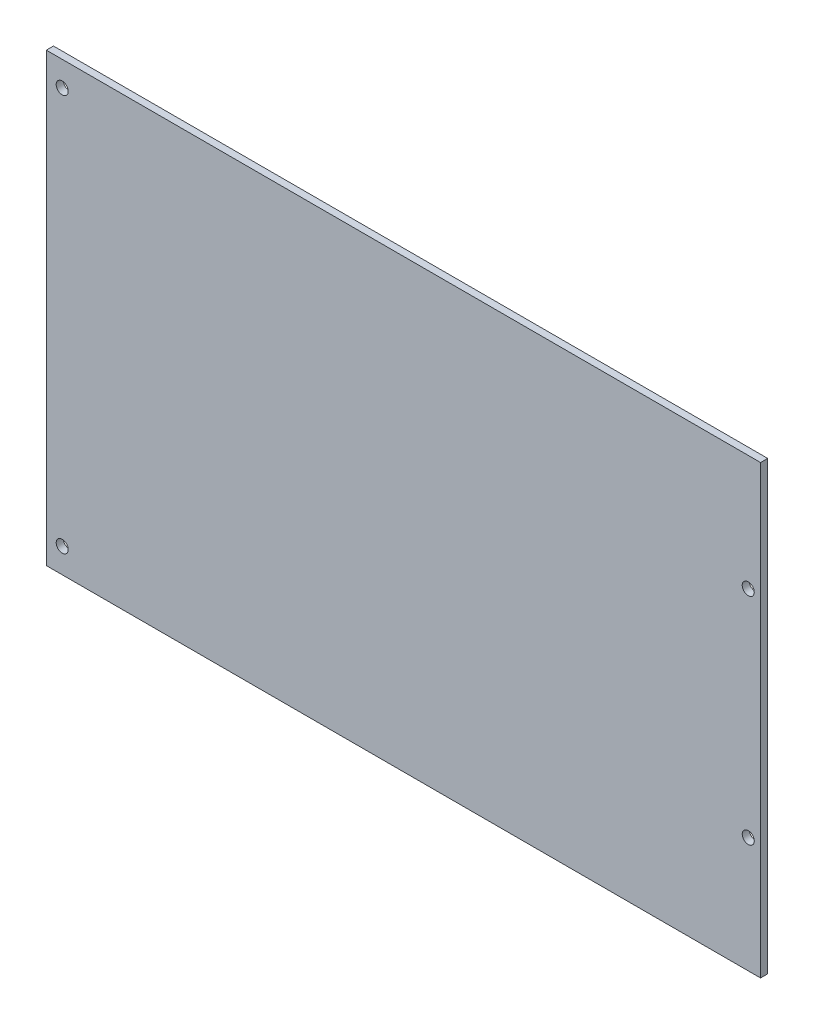
from build123d import *

# Parameters (mm, degrees)
ESQUISSE1_W                     = 160
ESQUISSE1_H                     = 100
BOSS_EXTRU_1_DEPTH              = 1.6
DIAM_TRE_DU_PER_AGE_2_7_2_7_1_D = 2.7
DIAM_TRE_DU_PER_AGE_2_7_2_7_2_D = 2.7


with BuildPart() as part:
    # Esquisse1 → Boss.-Extru.1 (new body)
    with BuildSketch(Plane.XY):
        Rectangle(ESQUISSE1_W, ESQUISSE1_H)
    extrude(amount=BOSS_EXTRU_1_DEPTH)

    # Diamètre du perçage Ø2.7 (2.7)1 (through all)
    with Locations(Plane.XY.offset(1.6)):
        with Locations((-76.43, 44.45), (-76.43, -44.45)):
            Hole(DIAM_TRE_DU_PER_AGE_2_7_2_7_1_D / 2)

    # Diamètre du perçage Ø2.7 (2.7)2 (through all)
    with Locations(Plane.XY.offset(1.6)):
        with Locations((77.24, 24.13), (77.24, -24.13)):
            Hole(DIAM_TRE_DU_PER_AGE_2_7_2_7_2_D / 2)


solid = part.part
